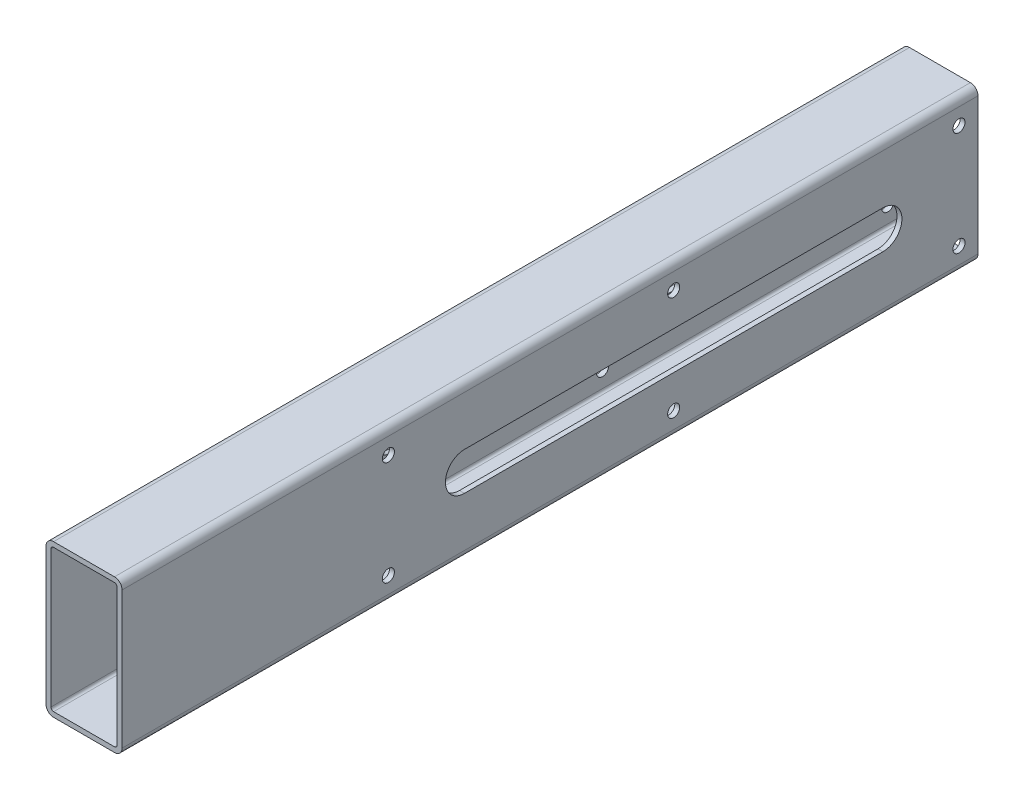
from build123d import *

# Parameters (mm, degrees)
EXTRUDE_THIN1_DEPTH = 285.75
CUT_EXTRUDE1_DEPTH  = 288.998927949
SKETCH4_R           = 2.0193
CUT_EXTRUDE3_DEPTH  = 288.998927949


with BuildPart() as part:
    # Sketch1 → Extrude-Thin1 (new body)
    with BuildSketch(Plane.XY):
        with BuildLine():
            Line((-10.16, 25.4), (10.16, 25.4))
            ThreePointArc((10.16, 25.4), (11.956051224, 24.656051224), (12.7, 22.86))
            Line((12.7, 22.86), (12.7, -22.86))
            ThreePointArc((12.7, -22.86), (11.956051224, -24.656051224), (10.16, -25.4))
            Line((10.16, -25.4), (-10.16, -25.4))
            ThreePointArc((-10.16, -25.4), (-11.956051224, -24.656051224), (-12.7, -22.86))
            Line((-12.7, -22.86), (-12.7, 22.86))
            ThreePointArc((-12.7, 22.86), (-11.956051224, 24.656051224), (-10.16, 25.4))
        make_face()
        with BuildLine():
            Line((-10.16, 23.749), (10.16, 23.749))
            ThreePointArc((10.16, 23.749), (10.788617928, 23.488617928), (11.049, 22.86))
            Line((11.049, 22.86), (11.049, -22.86))
            ThreePointArc((11.049, -22.86), (10.788617928, -23.488617928), (10.16, -23.749))
            Line((10.16, -23.749), (-10.16, -23.749))
            ThreePointArc((-10.16, -23.749), (-10.788617928, -23.488617928), (-11.049, -22.86))
            Line((-11.049, -22.86), (-11.049, 22.86))
            ThreePointArc((-11.049, 22.86), (-10.788617928, 23.488617928), (-10.16, 23.749))
        make_face(mode=Mode.SUBTRACT)
    extrude(amount=EXTRUDE_THIN1_DEPTH)

    # Sketch2 → Cut-Extrude1 (cut, through all)
    with BuildSketch(Plane.ZY.offset(12.7)):
        with BuildLine():
            Line((31.75, 6.35), (171.45, 6.35))
            ThreePointArc((171.45, 6.35), (177.8, 0), (171.45, -6.35))
            Line((171.45, -6.35), (31.75, -6.35))
            ThreePointArc((31.75, -6.35), (25.4, 0), (31.75, 6.35))
        make_face()
    extrude(amount=-CUT_EXTRUDE1_DEPTH, mode=Mode.SUBTRACT)

    # Sketch4 → Cut-Extrude3 (cut, through all)
    with BuildSketch(Plane(origin=(12.7, 0, 0), x_dir=(0, 0, -1), z_dir=(1, 0, 0))):
        with Locations((-196.85, 17.399)):
            Circle(SKETCH4_R)
        with Locations((-196.85, -17.399)):
            Circle(SKETCH4_R)
        with Locations((-101.6, 17.399)):
            Circle(SKETCH4_R)
        with Locations((-101.6, -17.399)):
            Circle(SKETCH4_R)
        with Locations((-6.35, 17.399)):
            Circle(SKETCH4_R)
        with Locations((-6.35, -17.399)):
            Circle(SKETCH4_R)
    extrude(amount=-CUT_EXTRUDE3_DEPTH, mode=Mode.SUBTRACT)


solid = part.part
